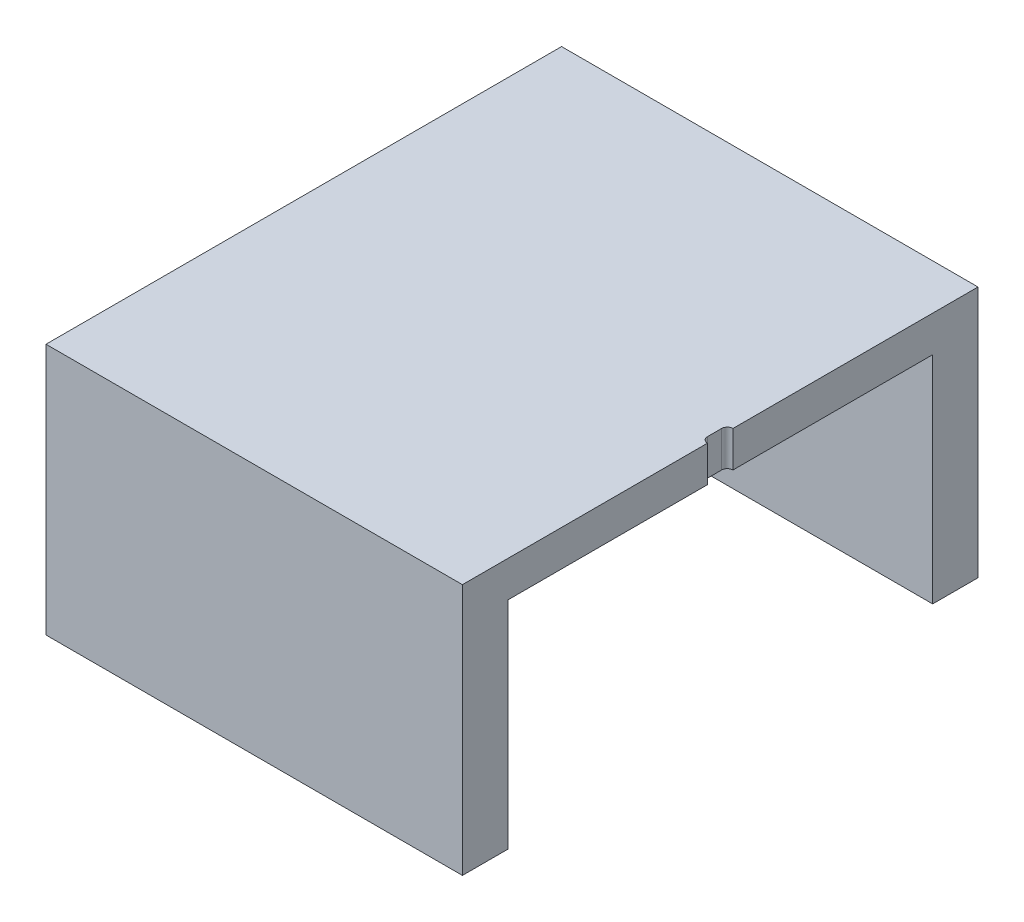
from build123d import *

# Parameters (mm, degrees)
WALL_DEPTH                = 19.05
ROOF_START                = 19.05
ROOF_DEPTH                = 3.175
F_2_56_TAPPED_HOLE1_D     = 1.778
F_2_56_TAPPED_HOLE1_DEPTH = 5.73
F_2_56_TAPPED_HOLE1_TIP   = 0.53416509


with BuildPart() as part:
    # MainSketch → Wall (new body)
    with BuildSketch(Plane(origin=(0, 0, 0), x_dir=(1, 0, 0), z_dir=(0, 1, 0))):
        Polygon((-32.75, -4), (0, -4), (0, 0), (-36.75, 0), (-36.75, -45.5), (0, -45.5), (0, -41.5), (-32.75, -41.5), align=None)
    extrude(amount=WALL_DEPTH)

    # MainSketch<3> → Roof (add)
    with BuildSketch(Plane(origin=(0, 0, 0), x_dir=(1, 0, 0), z_dir=(0, 1, 0)).offset(ROOF_START)):
        with BuildLine():
            Line((0, -21.625), (0, 0))
            Line((0, 0), (-36.75, 0))
            Line((-36.75, 0), (-36.75, -45.5))
            Line((-36.75, -45.5), (0, -45.5))
            Line((0, -45.5), (0, -23.875))
            ThreePointArc((0, -23.875), (-0.353553391, -23.728553391), (-0.5, -23.375))
            Line((-0.5, -23.375), (-0.5, -22.125))
            ThreePointArc((-0.5, -22.125), (-0.353553391, -21.771446609), (0, -21.625))
        make_face()
    extrude(amount=ROOF_DEPTH)

    # #2-56 Tapped Hole1
    with Locations(Plane(origin=(-10, 0, 43), x_dir=(0, 0, -1), z_dir=(0, -1, 0))):
        with Locations((0, 0), (0, -24.25), (40.5, -24.25), (40.5, 0)):
            Hole(F_2_56_TAPPED_HOLE1_D / 2, depth=F_2_56_TAPPED_HOLE1_DEPTH)
            with Locations((0, 0, -(F_2_56_TAPPED_HOLE1_DEPTH + F_2_56_TAPPED_HOLE1_TIP / 2))):  # 118° drill point
                Cone(0, F_2_56_TAPPED_HOLE1_D / 2, F_2_56_TAPPED_HOLE1_TIP, mode=Mode.SUBTRACT)


solid = part.part
